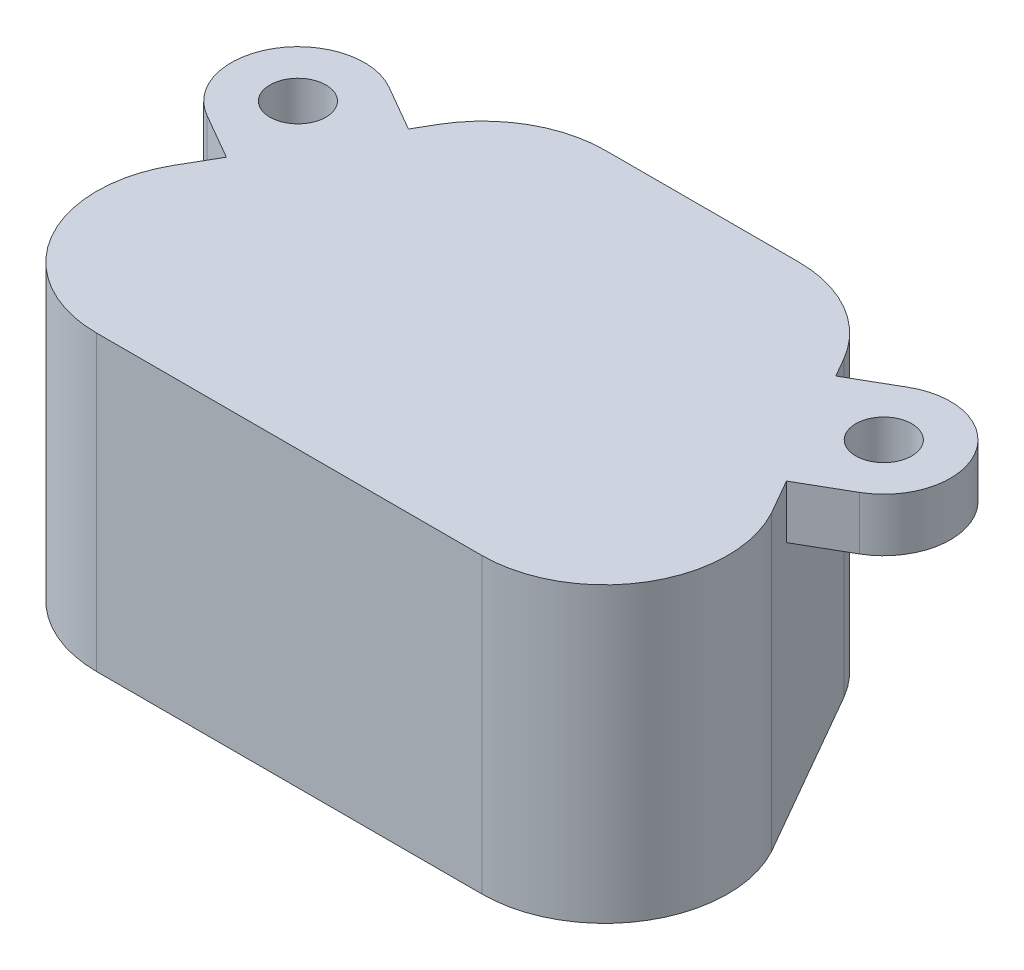
from build123d import *

# Parameters (mm, degrees)
BOSS_EXTRUDE1_DEPTH = 20
BOSS_EXTRUDE4_DEPTH = 2
SKETCH9_R           = 2.1
BOSS_EXTRUDE5_DEPTH = 4


with BuildPart() as part:
    # Sketch1 → Boss-Extrude1 (new body)
    with BuildSketch(Plane(origin=(0, 0, 0), x_dir=(1, 0, 0), z_dir=(0, 1, 0))):
        with BuildLine():
            Line((-47.421696664, 8.493167766), (-32.921696664, 8.493167766))
            ThreePointArc((-32.921696664, 8.493167766), (-28.309146849, 7.256965456), (-24.933036081, 3.879734634))
            Line((-24.933036081, 3.879734634), (-17.636401145, -8.844865692))
            ThreePointArc((-17.636401145, -8.844865692), (-17.820612025, -17.958509448), (-25.745395692, -22.46297834))
            Line((-25.745395692, -22.46297834), (-54.645395692, -22.46297834))
            ThreePointArc((-54.645395692, -22.46297834), (-62.607823184, -17.894709582), (-62.682753297, -8.715182552))
            Line((-62.682753297, -8.715182552), (-55.348980831, 3.984497041))
            ThreePointArc((-55.348980831, 3.984497041), (-51.981574567, 7.287152643), (-47.421696664, 8.493167766))
        make_face()
        with BuildLine():
            Line((-47.421696664, 6.493167766), (-32.921696664, 6.493167766))
            ThreePointArc((-32.921696664, 6.493167766), (-29.310446688, 5.525665157), (-26.666587696, 2.882334433))
            Line((-26.666587696, 2.882334433), (-19.384059263, -9.817665567))
            ThreePointArc((-19.384059263, -9.817665567), (-19.544805292, -16.944941641), (-25.745395692, -20.46297834))
            Line((-25.745395692, -20.46297834), (-54.645395692, -20.46297834))
            ThreePointArc((-54.645395692, -20.46297834), (-60.878636724, -16.889747838), (-60.944972269, -9.705259715))
            Line((-60.944972269, -9.705259715), (-53.623842396, 2.97252707))
            ThreePointArc((-53.623842396, 2.97252707), (-50.987559904, 5.551646576), (-47.421696664, 6.493167766))
        make_face(mode=Mode.SUBTRACT)
    extrude(amount=BOSS_EXTRUDE1_DEPTH)

    # Sketch8 → Boss-Extrude4 (add)
    with BuildSketch(Plane(origin=(0, 20, 0), x_dir=(1, 0, 0), z_dir=(0, 1, 0))):
        with BuildLine():
            Line((-55.348980831, 3.984497041), (-62.682753297, -8.715182552))
            ThreePointArc((-62.682753297, -8.715182552), (-62.607823184, -17.894709582), (-54.645395692, -22.462978339))
            Line((-54.645395692, -22.462978339), (-25.745395692, -22.46297834))
            ThreePointArc((-25.745395692, -22.46297834), (-17.820612025, -17.958509448), (-17.636401145, -8.844865692))
            Line((-17.636401145, -8.844865692), (-24.933036081, 3.879734634))
            ThreePointArc((-24.933036081, 3.879734634), (-28.309146849, 7.256965456), (-32.921696664, 8.493167766))
            Line((-32.921696664, 8.493167766), (-47.421696664, 8.493167766))
            ThreePointArc((-47.421696664, 8.493167766), (-51.981574567, 7.287152643), (-55.348980831, 3.984497041))
        make_face()
    extrude(amount=BOSS_EXTRUDE4_DEPTH)

    # Sketch9 → Boss-Extrude5 (add)
    # profile 1 of 2: a face of its own
    with BuildSketch(Plane(origin=(0, 22, 0), x_dir=(1, 0, 0), z_dir=(0, 1, 0))):
        with BuildLine():
            Line((-59.674100701, 4.493496912), (-56.210189139, 2.493167766))
            Line((-56.210189139, 2.493167766), (-61.211012004, -6.166611138))
            Line((-61.211012004, -6.166611138), (-64.674923565, -4.166281993))
            ThreePointArc((-64.674923565, -4.166281993), (-66.504401585, 2.664018892), (-59.674100701, 4.493496912))
        make_face()
        with Locations(Location((-62.174512133, 0.16360746, 0), (0, 0, 270))):
            Circle(SKETCH9_R, mode=Mode.SUBTRACT)
    # profile 2 of 2: a face of its own
    with BuildSketch(Plane(origin=(0, 22, 0), x_dir=(1, 0, 0), z_dir=(0, 1, 0))):
        with BuildLine():
            Line((-19.154852081, -6.198807979), (-24.142409797, 2.468617708))
            Line((-24.142409797, 2.468617708), (-20.675439522, 4.463640794))
            ThreePointArc((-20.675439522, 4.463640794), (-13.847947821, 2.623706808), (-15.687881807, -4.203784893))
            Line((-15.687881807, -4.203784893), (-19.154852081, -6.198807979))
        make_face()
        with Locations(Location((-18.181660664, 0.12992795, 0), (0, 0, 90))):
            Circle(SKETCH9_R, mode=Mode.SUBTRACT)
    extrude(amount=-BOSS_EXTRUDE5_DEPTH)


solid = part.part
